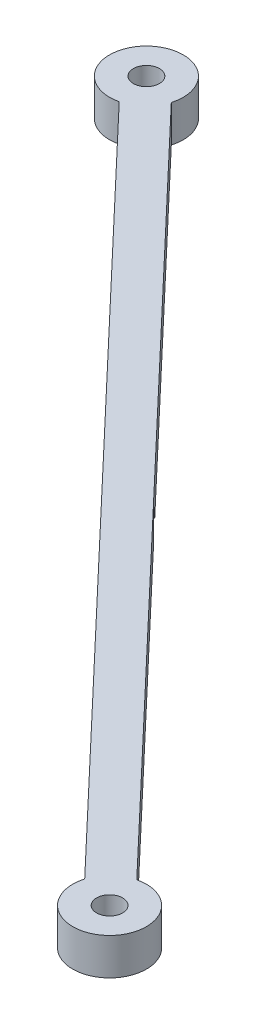
from build123d import *

# Parameters (mm, degrees)
SKETCH1_R           = 2.2479
BOSS_EXTRUDE1_DEPTH = 6.35
CUT_EXTRUDE1_DEPTH  = 3.175


with BuildPart() as part:
    # Sketch1 → Boss-Extrude1 (new body)
    with BuildSketch(Plane(origin=(0, 0, 0), x_dir=(1, 0, 0), z_dir=(0, 1, 0))):
        with BuildLine():
            ThreePointArc((-22.298722012, -8.227846676), (-32.761767568, -1.823918477), (-26.902468415, -12.601405759))
            Line((-26.902468415, -12.601405759), (86.172305043, -131.627483084))
            ThreePointArc((86.172305043, -131.627483084), (96.635350599, -138.031411283), (90.776051446, -127.253924001))
            Line((90.776051446, -127.253924001), (-22.298722012, -8.227846676))
        make_face()
        with Locations(Location((92.261791516, -133.42766488, 0), (0, 0, 270))):
            Circle(SKETCH1_R, mode=Mode.SUBTRACT)
        with Locations(Location((-28.388208484, -6.42766488, 0), (0, 0, 270))):
            Circle(SKETCH1_R, mode=Mode.SUBTRACT)
    extrude(amount=BOSS_EXTRUDE1_DEPTH)

    # Sketch2 → Cut-Extrude1 (cut)
    with BuildSketch(Plane.XZ):
        Polygon((31.927377379, 65.307951298), (27.564134606, 69.934672098), (31.854628611, 74.63797054), (36.322762187, 69.934672148), align=None)
    extrude(amount=-CUT_EXTRUDE1_DEPTH, mode=Mode.SUBTRACT)


solid = part.part
